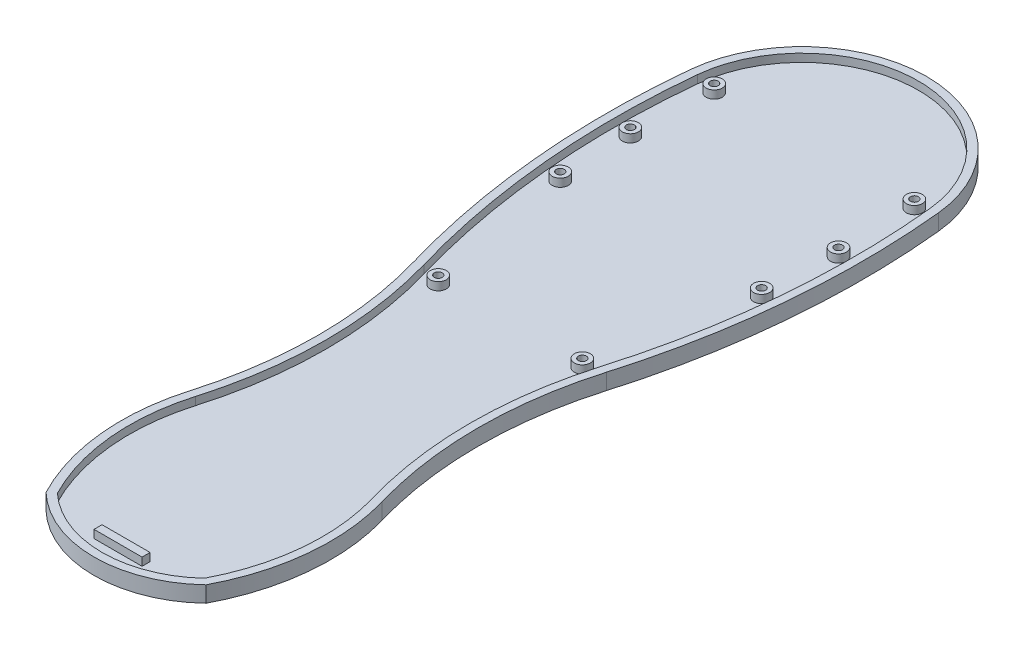
from build123d import *

# Parameters (mm, degrees)
BOSS_EXTRUDE1_DEPTH = 3.175
CUT_EXTRUDE1_DEPTH  = 1.5875
SKETCH2_R           = 1.5875
SKETCH2_R_2         = 0.79375
SKETCH2_W           = 9.525
SKETCH2_H           = 1.5875
BOSS_EXTRUDE3_DEPTH = 1.5875


with BuildPart() as part:
    # Sketch1 → Boss-Extrude1 (new body)
    with BuildSketch(Plane(origin=(0, 0, 0), x_dir=(1, 0, 0), z_dir=(0, 1, 0))):
        with BuildLine():
            ThreePointArc((-24.608229426, 60.285411471), (0, 82.55), (24.608229426, 60.285411471))
            ThreePointArc((24.608229426, 60.285411471), (24.729538057, 29.875290817), (19.05, 0))
            ThreePointArc((19.05, 0), (15.875, -22.225), (19.05, -44.45))
            ThreePointArc((19.05, -44.45), (20.544089225, -60.633158922), (15.875, -76.2))
            ThreePointArc((15.875, -76.2), (0, -82.55), (-15.875, -76.2))
            ThreePointArc((-15.875, -76.2), (-20.544089225, -60.633158922), (-19.05, -44.45))
            ThreePointArc((-19.05, -44.45), (-15.875, -22.225), (-19.05, 0))
            ThreePointArc((-19.05, 0), (-24.729538057, 29.875290817), (-24.608229426, 60.285411471))
        make_face()
    extrude(amount=BOSS_EXTRUDE1_DEPTH)

    # Sketch3 → Cut-Extrude1 (cut)
    with BuildSketch(Plane(origin=(0, 3.175, 0), x_dir=(1, 0, 0), z_dir=(0, 1, 0))):
        with BuildLine():
            ThreePointArc((-17.526, -44.8945), (-18.977391367, -60.343827238), (-14.591091342, -75.228336673))
            ThreePointArc((-14.591091342, -75.228336673), (0, -80.9625), (14.591091342, -75.228336673))
            ThreePointArc((14.591091342, -75.228336673), (18.977391367, -60.343827238), (17.526, -44.8945))
            ThreePointArc((17.526, -44.8945), (14.2875, -22.225), (17.526, 0.4445))
            ThreePointArc((17.526, 0.4445), (23.148742676, 30.021037909), (23.028647132, 60.127057357))
            ThreePointArc((23.028647132, 60.127057357), (0, 80.9625), (-23.028647132, 60.127057357))
            ThreePointArc((-23.028647132, 60.127057357), (-23.148742676, 30.021037909), (-17.526, 0.4445))
            ThreePointArc((-17.526, 0.4445), (-14.2875, -22.225), (-17.526, -44.8945))
        make_face()
    extrude(amount=-CUT_EXTRUDE1_DEPTH, mode=Mode.SUBTRACT)

    # Sketch2 → Boss-Extrude3 (add)
    # profile 1 of 9: a face of its own
    with BuildSketch(Plane(origin=(0, 3.175, 0), x_dir=(1, 0, 0), z_dir=(0, 1, 0))):
        with Locations(Location((-19.845729426, 60.285411471, 0), (0, 0, 270))):
            Circle(SKETCH2_R)
        with Locations(Location((-19.845729426, 60.285411471, 0), (0, 0, 270))):
            Circle(SKETCH2_R_2, mode=Mode.SUBTRACT)
    # profile 2 of 9: a face of its own
    with BuildSketch(Plane(origin=(0, 3.175, 0), x_dir=(1, 0, 0), z_dir=(0, 1, 0))):
        with Locations(Location((-20.6375, 44.45, 0), (0, 0, 270))):
            Circle(SKETCH2_R)
        with Locations(Location((-20.6375, 44.45, 0), (0, 0, 270))):
            Circle(SKETCH2_R_2, mode=Mode.SUBTRACT)
    # profile 3 of 9: a face of its own
    with BuildSketch(Plane(origin=(0, 3.175, 0), x_dir=(1, 0, 0), z_dir=(0, 1, 0))):
        with Locations(Location((-19.967038057, 29.875290817, 0), (0, 0, 270))):
            Circle(SKETCH2_R)
        with Locations(Location((-19.967038057, 29.875290817, 0), (0, 0, 270))):
            Circle(SKETCH2_R_2, mode=Mode.SUBTRACT)
    # profile 4 of 9: a face of its own
    with BuildSketch(Plane(origin=(0, 3.175, 0), x_dir=(1, 0, 0), z_dir=(0, 1, 0))):
        with Locations(Location((-14.2875, 0, 0), (0, 0, 270))):
            Circle(SKETCH2_R)
        with Locations(Location((-14.2875, 0, 0), (0, 0, 270))):
            Circle(SKETCH2_R_2, mode=Mode.SUBTRACT)
    # profile 5 of 9: a face of its own
    with BuildSketch(Plane(origin=(0, 3.175, 0), x_dir=(1, 0, 0), z_dir=(0, 1, 0))):
        with Locations(Location((19.845729426, 60.285411471, 0), (0, 0, 270))):
            Circle(SKETCH2_R)
        with Locations(Location((19.845729426, 60.285411471, 0), (0, 0, 270))):
            Circle(SKETCH2_R_2, mode=Mode.SUBTRACT)
    # profile 6 of 9: a face of its own
    with BuildSketch(Plane(origin=(0, 3.175, 0), x_dir=(1, 0, 0), z_dir=(0, 1, 0))):
        with Locations(Location((20.6375, 44.45, 0), (0, 0, 270))):
            Circle(SKETCH2_R)
        with Locations(Location((20.6375, 44.45, 0), (0, 0, 270))):
            Circle(SKETCH2_R_2, mode=Mode.SUBTRACT)
    # profile 7 of 9: a face of its own
    with BuildSketch(Plane(origin=(0, 3.175, 0), x_dir=(1, 0, 0), z_dir=(0, 1, 0))):
        with Locations(Location((19.967038057, 29.875290817, 0), (0, 0, 270))):
            Circle(SKETCH2_R)
        with Locations(Location((19.967038057, 29.875290817, 0), (0, 0, 270))):
            Circle(SKETCH2_R_2, mode=Mode.SUBTRACT)
    # profile 8 of 9: a face of its own
    with BuildSketch(Plane(origin=(0, 3.175, 0), x_dir=(1, 0, 0), z_dir=(0, 1, 0))):
        with Locations(Location((14.2875, 0, 0), (0, 0, 270))):
            Circle(SKETCH2_R)
        with Locations(Location((14.2875, 0, 0), (0, 0, 270))):
            Circle(SKETCH2_R_2, mode=Mode.SUBTRACT)
    # profile 9 of 9: a face of its own
    with BuildSketch(Plane(origin=(0, 3.175, 0), x_dir=(1, 0, 0), z_dir=(0, 1, 0))):
        with Locations((0, -76.99375)):
            Rectangle(SKETCH2_W, SKETCH2_H)
    extrude(amount=-BOSS_EXTRUDE3_DEPTH)


solid = part.part
